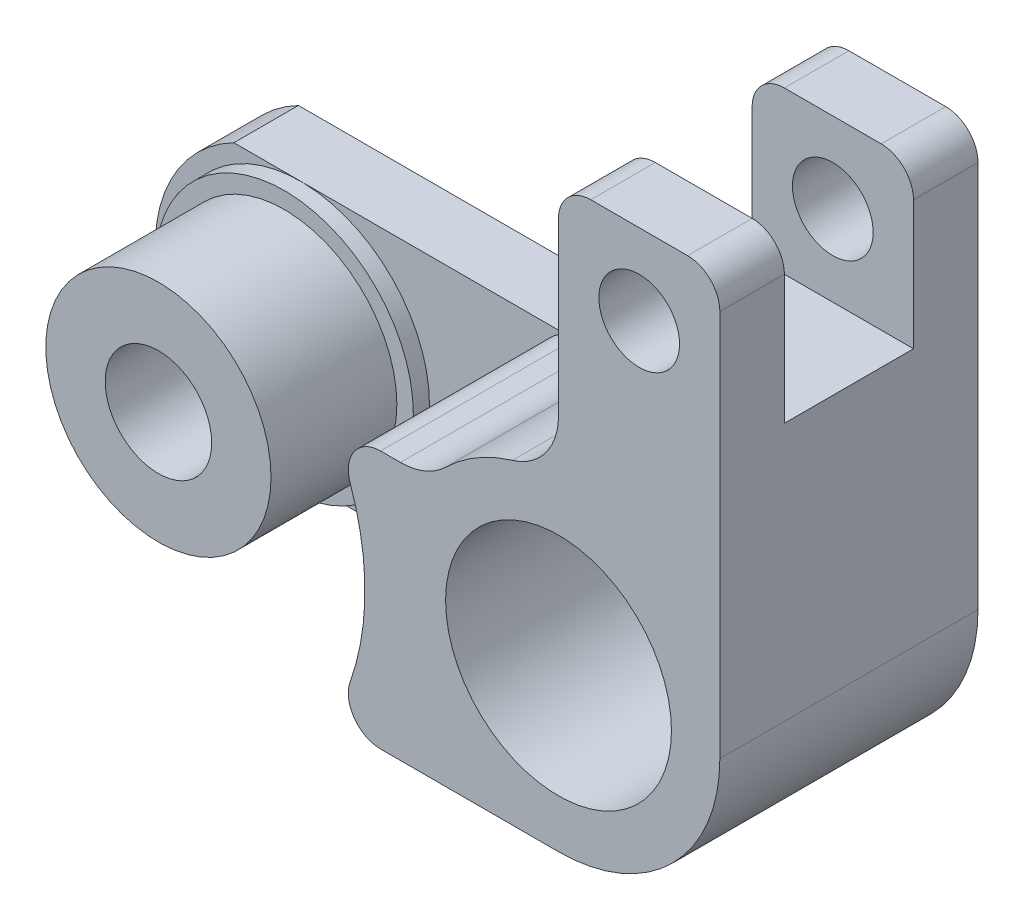
from build123d import *

# Parameters (mm, degrees)
BOSS_EXTRU_1_DEPTH           = 8
ESQUISSE2_R                  = 5
BOSS_EXTRU_2_DEPTH           = 8
ESQUISSE3_R                  = 3.5
ENL_V_MAT_EXTRU_1_DEPTH      = 7
ENL_V_MAT_EXTRU_2_DEPTH      = 31.805843601
ENL_V_MAT_EXTRU_2_DEPTH_BACK = 31.805843601
ESQUISSE4_R                  = 2.5
ESQUISSE5_R                  = 8
ENL_V_MAT_EXTRU_3_DEPTH      = 6
ESQUISSE6_R                  = 3.49
BOSS_EXTRU_3_DEPTH           = 4.4
ENL_V_MAT_EXTRU_4_DEPTH      = 31.675071312
ENL_V_MAT_EXTRU_4_DEPTH_BACK = 31.675071312
ESQUISSE7_R                  = 1.65
ENL_V_MAT_EXTRU_5_DEPTH      = 31.594117082
ENL_V_MAT_EXTRU_5_DEPTH_BACK = 31.594117082
CONG_1_R                     = 5
CONG_2_R                     = 1
ESQUISSE9_W                  = 5
ESQUISSE9_H                  = 4
ENL_V_MAT_EXTRU_6_DEPTH      = 5
CONG_3_R                     = 2
ENL_V_MAT_EXTRU_7_DEPTH      = 32.048349393
ENL_V_MAT_EXTRU_7_DEPTH_BACK = 32.048349393
ESQUISSE10_R                 = 1.25
BOSS_EXTRU_4_START           = -4.4
ESQUISSE11_R                 = 4
ESQUISSE11_R_2               = 3.49
BOSS_EXTRU_4_DEPTH           = 0.5


with BuildPart() as part:
    # Esquisse1 → Boss.-Extru.1 (new body)
    with BuildSketch(Plane.XY):
        Polygon((0, 0), (24, 0), (24, 18), (19, 18), (19, 8), (0, 8), align=None)
    extrude(amount=BOSS_EXTRU_1_DEPTH)

    # Esquisse2 → Boss.-Extru.2 (add)
    with BuildSketch(Plane.XY.offset(8)):
        with Locations((19, 5)):
            Circle(ESQUISSE2_R)
    extrude(amount=-BOSS_EXTRU_2_DEPTH)

    # Esquisse3 → Enlèv. mat.-Extru.1 (cut)
    with BuildSketch(Plane.XY.offset(8)):
        with Locations((19, 5)):
            Circle(ESQUISSE3_R)
    extrude(amount=-ENL_V_MAT_EXTRU_1_DEPTH, mode=Mode.SUBTRACT)

    # Esquisse4 → Enlèv. mat.-Extru.2 (cut, two sides: drawn at the far end of the back side and taken through both)
    with BuildSketch(Plane.XY.offset(1).offset(-ENL_V_MAT_EXTRU_2_DEPTH_BACK)):
        with Locations((19, 5)):
            Circle(ESQUISSE4_R)
    extrude(amount=ENL_V_MAT_EXTRU_2_DEPTH + ENL_V_MAT_EXTRU_2_DEPTH_BACK, mode=Mode.SUBTRACT)

    # Esquisse5 → Enlèv. mat.-Extru.3 (cut)
    with BuildSketch(Plane.XY.offset(8)):
        with Locations((5, 4)):
            Circle(ESQUISSE5_R)
    extrude(amount=-ENL_V_MAT_EXTRU_3_DEPTH, mode=Mode.SUBTRACT)

    # Esquisse6 → Boss.-Extru.3 (add)
    with BuildSketch(Plane.XY.offset(2)):
        with Locations((5, 4)):
            Circle(ESQUISSE6_R)
    extrude(amount=BOSS_EXTRU_3_DEPTH)

    # Esquisse7 → Enlèv. mat.-Extru.4 (cut, two sides: drawn at the far end of the back side and taken through both)
    with BuildSketch(Plane.XY.offset(6.4).offset(-ENL_V_MAT_EXTRU_4_DEPTH_BACK)):
        with Locations((5, 4)):
            Circle(ESQUISSE7_R)
    extrude(amount=ENL_V_MAT_EXTRU_4_DEPTH + ENL_V_MAT_EXTRU_4_DEPTH_BACK, mode=Mode.SUBTRACT)

    # Esquisse8 → Enlèv. mat.-Extru.5 (cut, two sides: drawn at the far end of the back side and taken through both)
    with BuildSketch(Plane.XY.offset(2).offset(-ENL_V_MAT_EXTRU_5_DEPTH_BACK)):
        with BuildLine():
            Line((0, 8), (2.938447187, 8))
            ThreePointArc((2.938447187, 8), (0.5, 4), (2.938447187, 0))
            Line((2.938447187, 0), (0, 0))
            Line((0, 0), (0, 8))
        make_face()
    extrude(amount=ENL_V_MAT_EXTRU_5_DEPTH + ENL_V_MAT_EXTRU_5_DEPTH_BACK, mode=Mode.SUBTRACT)

    # Congé1
    cong_1_edges = [part.edges().sort_by_distance(p)[0] for p in [
        (24, 0, 4),
    ]]
    fillet(cong_1_edges, radius=CONG_1_R)

    # Congé2
    cong_2_edges = [part.edges().sort_by_distance(p)[0] for p in [
        (19, 18, 4),
        (24, 18, 4),
        (11.92820323, 0, 5),
        (11.92820323, 8, 5),
    ]]
    fillet(cong_2_edges, radius=CONG_2_R)

    # Esquisse9 → Enlèv. mat.-Extru.6 (cut)
    with BuildSketch(Plane(origin=(0, 18, 0), x_dir=(1, 0, 0), z_dir=(0, 1, 0))):
        with Locations((21.5, -4)):
            Rectangle(ESQUISSE9_W, ESQUISSE9_H)
    extrude(amount=-ENL_V_MAT_EXTRU_6_DEPTH, mode=Mode.SUBTRACT)

    # Congé3
    cong_3_edges = [part.edges().sort_by_distance(p)[0] for p in [
        (19, 10, 4),
        (15, 8, 4),
    ]]
    fillet(cong_3_edges, radius=CONG_3_R)

    # Esquisse10 → Enlèv. mat.-Extru.7 (cut, two sides: drawn at the far end of the back side and taken through both)
    with BuildSketch(Plane.XY.offset(8).offset(-ENL_V_MAT_EXTRU_7_DEPTH_BACK)):
        with Locations((21.5, 15.5)):
            Circle(ESQUISSE10_R)
    extrude(amount=ENL_V_MAT_EXTRU_7_DEPTH + ENL_V_MAT_EXTRU_7_DEPTH_BACK, mode=Mode.SUBTRACT)


with BuildPart() as body_2:
    # Esquisse11 → Boss.-Extru.4 (new body)
    with BuildSketch(Plane.XY.offset(6.4).offset(BOSS_EXTRU_4_START)):
        with Locations((5, 4)):
            Circle(ESQUISSE11_R)
        with Locations((5, 4)):
            Circle(ESQUISSE11_R_2, mode=Mode.SUBTRACT)
    extrude(amount=BOSS_EXTRU_4_DEPTH)


solid = Compound([part.part, body_2.part])
